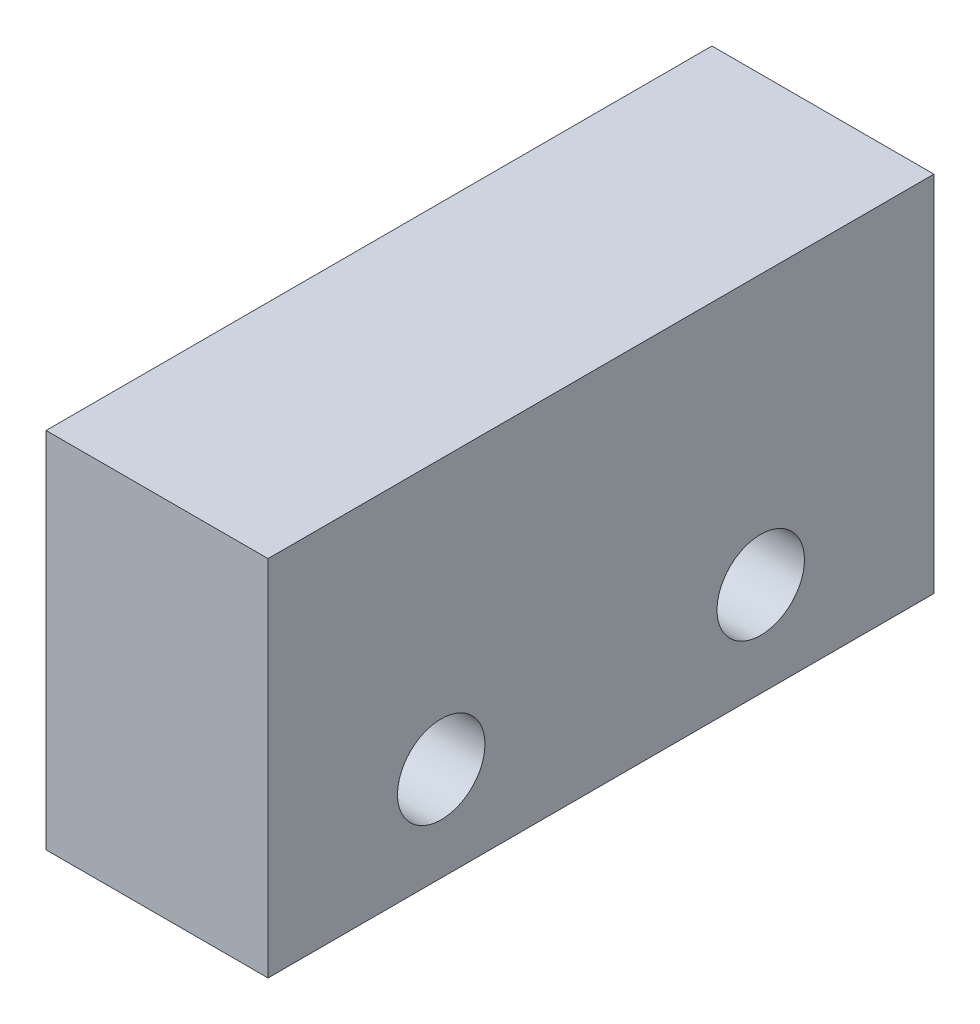
from build123d import *

# Parameters (mm, degrees)
SKETCH_1_W          = 19.8
SKETCH_1_H          = 10.8
EXTRUDE_1_DEPTH     = 6.6
SKETCH_2_R          = 1.3
CUT_EXTRUDE_1_DEPTH = 6.6


with BuildPart() as part:
    # 草图1 → 凸台-拉伸1 (new body)
    with BuildSketch(Plane(origin=(0, 0, 0), x_dir=(0, 0, -1), z_dir=(1, 0, 0))):
        with Locations((9.9, -5.4)):
            Rectangle(SKETCH_1_W, SKETCH_1_H)
    extrude(amount=EXTRUDE_1_DEPTH)

    # 草图2 → 切除-拉伸1 (cut)
    with BuildSketch(Plane(origin=(6.6, 0, 0), x_dir=(0, 0, -1), z_dir=(1, 0, 0))):
        with Locations((5.15, -8)):
            Circle(SKETCH_2_R)
        with Locations((14.65, -8)):
            Circle(SKETCH_2_R)
    extrude(amount=-CUT_EXTRUDE_1_DEPTH, mode=Mode.SUBTRACT)


solid = part.part
